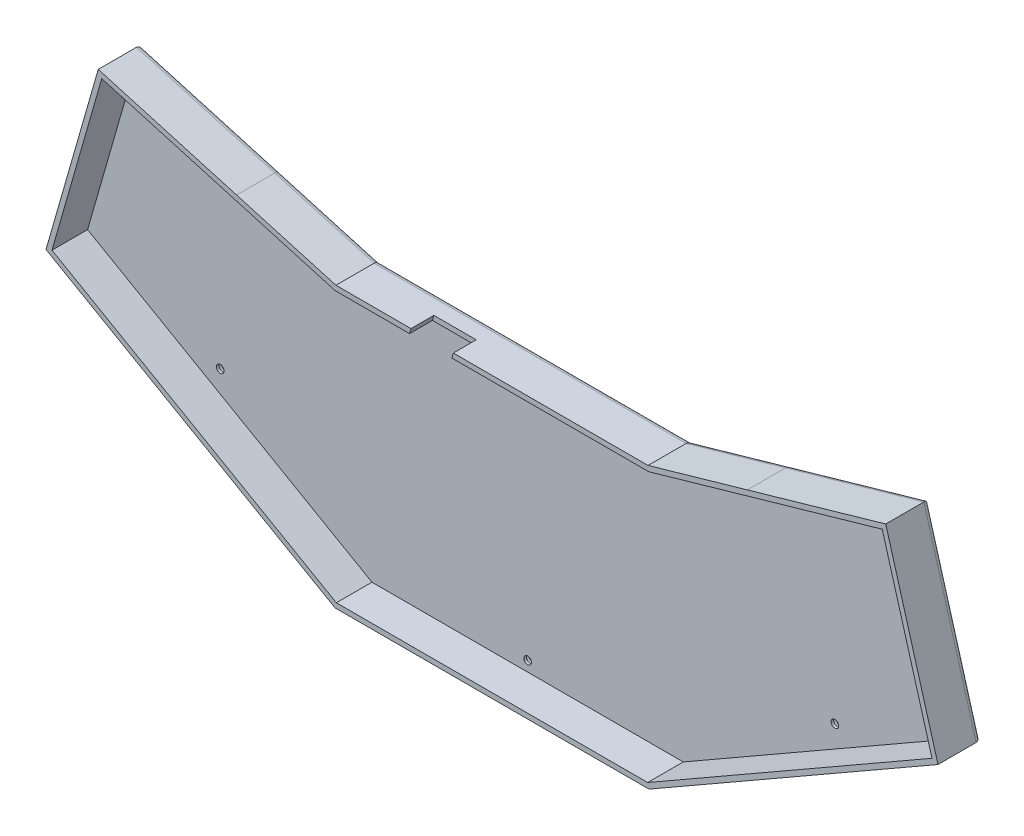
from build123d import *

# Parameters (mm, degrees)
BOSS_EXTRU_1_DEPTH      = 14
BOSS_EXTRU_2_DEPTH      = 3
CONG_1_R                = 2
ENL_V_START             = 5
ENL_V_MAT_EXTRU_1_DEPTH = 10
ESQUISSE7_R             = 1.5
ENL_V_MAT_EXTRU_2_DEPTH = 10
ESQUISSE8_R             = 3
ENL_V_MAT_EXTRU_3_DEPTH = 2


with BuildPart() as part:
    # Esquisse1 → Boss.-Extru.1 (new body)
    with BuildSketch(Plane.XY):
        Polygon((229.15721289, -14.84723942), (106.433306853, -14.84723942), (67.372523259, -3.649091023), (12.961214213, 11.953100779), (-7.58450021, -59.698320459), (106.05278448, -124.898736851), (229.537735263, -124.898736851), (343.175019953, -59.698320459), (322.62930553, 11.953100779), (268.217996484, -3.649091023), align=None)
        Polygon((229.438237844, -16.84723942), (106.152281899, -16.84723942), (66.821302011, -5.571629745), (14.332462893, 9.479302675), (-5.230075099, -58.743374877), (106.585792597, -122.898736851), (229.004727146, -122.898736851), (340.820594842, -58.743374877), (321.25805685, 9.479302675), (268.769217732, -5.571629745), align=None, mode=Mode.SUBTRACT)
    extrude(amount=BOSS_EXTRU_1_DEPTH)

    # Esquisse2 → Boss.-Extru.2 (add)
    with BuildSketch(Plane(origin=(0, 0, 0), x_dir=(-1, 0, 0), z_dir=(0, 0, -1))):
        Polygon((-229.15721289, -14.84723942), (-268.217996484, -3.649091023), (-322.62930553, 11.953100779), (-343.175019953, -59.698320459), (-229.537735263, -124.898736851), (-106.05278448, -124.898736851), (7.58450021, -59.698320459), (-12.961214213, 11.953100779), (-67.372523259, -3.649091023), (-106.433306853, -14.84723942), align=None)
    extrude(amount=BOSS_EXTRU_2_DEPTH)

    # Congé1
    cong_1_edges = [part.edges().sort_by_distance(p)[0] for p in [
        (167.795259872, -14.84723942, -3),
        (248.687604687, -9.248165222, -3),
        (295.423651007, 4.152004878, -3),
        (332.902162742, -23.87260984, -3),
        (286.356377608, -92.298528655, -3),
        (167.795259872, -124.898736851, -3),
        (49.234142135, -92.298528655, -3),
        (2.688357001, -23.87260984, -3),
        (40.166868736, 4.152004878, -3),
        (86.902915056, -9.248165222, -3),
    ]]
    fillet(cong_1_edges, radius=CONG_1_R)

    # Esquisse3 → Enlèv. mat.-Extru.1 (cut)
    with BuildSketch(Plane.XY.offset(ENL_V_START)):
        Polygon((142.206494045, 6.988548589), (157.586708491, 2.578446141), (132.665816954, -84.333062282), (117.285602508, -79.922959834), align=None)
    extrude(amount=ENL_V_MAT_EXTRU_1_DEPTH, mode=Mode.SUBTRACT)

    # Esquisse7 → Enlèv. mat.-Extru.2 (cut)
    with BuildSketch(Plane.XY):
        with Locations((312.747989314, 2.877882334)):
            Circle(ESQUISSE7_R)
        with Locations((167.795259872, -20.84723942)):
            Circle(ESQUISSE7_R)
        with Locations(Location((22.842530429, 2.877882334, 0), (0, 0, 180))):
            Circle(ESQUISSE7_R)
        with Locations(Location((167.795259872, -118.898736851, 0), (0, 0, 180))):
            Circle(ESQUISSE7_R)
        with Locations((46.946880967, -80.077290604)):
            Circle(ESQUISSE7_R)
        with Locations(Location((288.643638776, -80.077290604, 0), (0, 0, 180))):
            Circle(ESQUISSE7_R)
    extrude(amount=-ENL_V_MAT_EXTRU_2_DEPTH, mode=Mode.SUBTRACT)

    # Esquisse8 → Enlèv. mat.-Extru.3 (cut)
    with BuildSketch(Plane(origin=(0, 0, -3), x_dir=(-1, 0, 0), z_dir=(0, 0, -1))):
        with Locations((-22.842530429, 2.877882334)):
            Circle(ESQUISSE8_R)
        with Locations((-46.946880967, -80.077290604)):
            Circle(ESQUISSE8_R)
        with Locations((-167.795259872, -118.898736851)):
            Circle(ESQUISSE8_R)
        with Locations((-167.795259872, -20.84723942)):
            Circle(ESQUISSE8_R)
        with Locations((-288.643638776, -80.077290604)):
            Circle(ESQUISSE8_R)
        with Locations((-312.747989314, 2.877882334)):
            Circle(ESQUISSE8_R)
    extrude(amount=-ENL_V_MAT_EXTRU_3_DEPTH, mode=Mode.SUBTRACT)


solid = part.part
